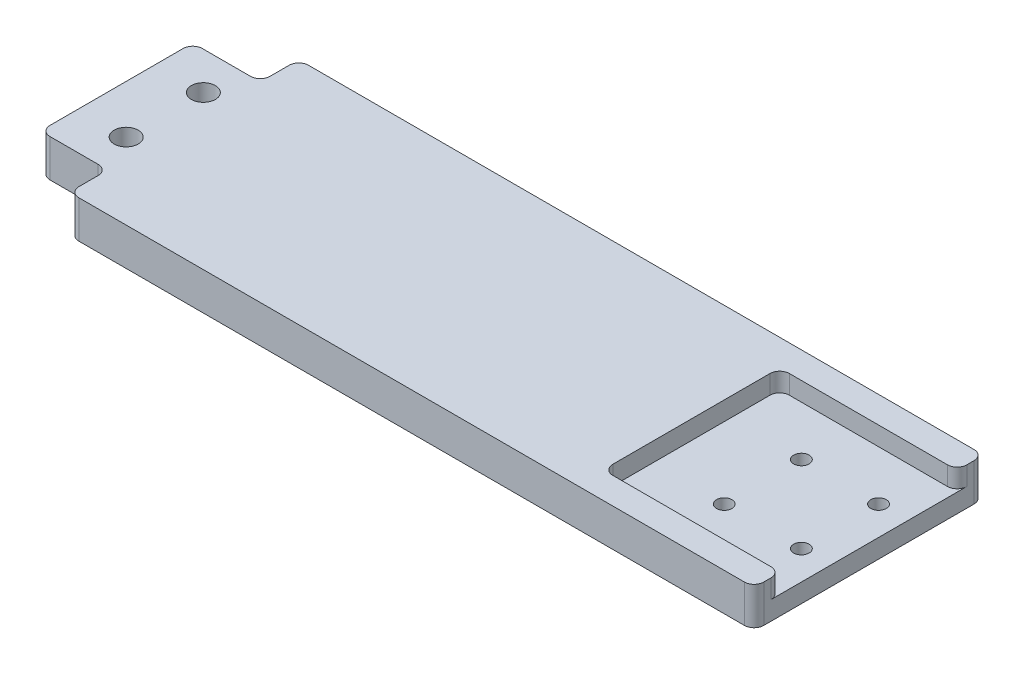
from build123d import *

# Parameters (mm, degrees)
SKETCH5_W            = 82
SKETCH5_H            = 23.8
BOSS_EXTRUDE1_DEPTH  = 3.9
M2_TAPPED_HOLE1_D    = 1.6
LPATTERN1_COUNT      = 2
LPATTERN1_PITCH      = 8
LPATTERN1_COUNT_DIR2 = 2
LPATTERN1_PITCH_DIR2 = 8
CUT_EXTRUDE2_START   = 3.9
REF_JOIN_CUT_FRONT_W = 18.4
REF_JOIN_CUT_FRONT_H = 18.3
CUT_EXTRUDE2_DEPTH   = 1.95
M3_TAPPED_HOLE2_D    = 2.5
LPATTERN2_COUNT      = 2
LPATTERN2_PITCH      = 8
CUT_EXTRUDE4_DEPTH   = 100.788877136
FILLET4_R            = 1
FILLET6_R            = 1


with BuildPart() as part:
    # Sketch5 → Boss-Extrude1 (new body)
    with BuildSketch(Plane(origin=(0, 0, 0), x_dir=(1, 0, 0), z_dir=(0, 1, 0))):
        with Locations((-58, 0)):
            Rectangle(SKETCH5_W, SKETCH5_H)
    extrude(amount=BOSS_EXTRUDE1_DEPTH)

    # M2 Tapped Hole1 (through all)
    with Locations(Plane(origin=(0, 3.9, 0), x_dir=(1, 0, 0), z_dir=(0, 1, 0))):
        with Locations((-20, 4)):
            m2_tapped_hole1 = Hole(M2_TAPPED_HOLE1_D / 2)

    # LPattern1: M2 Tapped Hole1 2 × 2
    with Locations(*[(-j * LPATTERN1_PITCH_DIR2, 0, i * LPATTERN1_PITCH) for i in range(LPATTERN1_COUNT) for j in range(LPATTERN1_COUNT_DIR2) if (i, j) != (0, 0)]):
        add(m2_tapped_hole1, mode=Mode.SUBTRACT)

    # Ref join cut, Front → Cut-Extrude2 (cut)
    with BuildSketch(Plane(origin=(0, 0, 0), x_dir=(-1, 0, 0), z_dir=(0, 1, 0)).offset(CUT_EXTRUDE2_START)):
        with Locations((26.2, 0)):
            Rectangle(REF_JOIN_CUT_FRONT_W, REF_JOIN_CUT_FRONT_H)
    extrude(amount=-CUT_EXTRUDE2_DEPTH, mode=Mode.SUBTRACT)

    # M3 Tapped Hole2 (through all)
    with Locations(Plane(origin=(0, 3.9, 0), x_dir=(1, 0, 0), z_dir=(0, 1, 0))):
        with Locations((-90, 4)):
            m3_tapped_hole2 = Hole(M3_TAPPED_HOLE2_D / 2)

    # LPattern2: M3 Tapped Hole2 ×2
    with Locations(*[(0, 0, i * LPATTERN2_PITCH) for i in range(1, LPATTERN2_COUNT)]):
        add(m3_tapped_hole2, mode=Mode.SUBTRACT)

    # Sketch13 → Cut-Extrude4 (cut, through all)
    with BuildSketch(Plane(origin=(0, 3.9, 0), x_dir=(1, 0, 0), z_dir=(0, 1, 0))):
        Polygon((-88, -11.9), (-88, -7.9), (-95, -7.9), (-95, 7.9), (-88, 7.9), (-88, 11.9), (-99, 11.9), (-99, -11.9), align=None)
    extrude(amount=-CUT_EXTRUDE4_DEPTH, mode=Mode.SUBTRACT)

    # Fillet4
    fillet4_edges = [part.edges().sort_by_distance(p)[0] for p in [
        (-88, 1.95, 11.9),
        (-88, 1.95, -11.9),
        (-88, 1.95, -7.9),
        (-95, 1.95, -7.9),
        (-95, 1.95, 7.9),
        (-88, 1.95, 7.9),
    ]]
    fillet(fillet4_edges, radius=FILLET4_R)

    # Fillet6
    fillet6_edges = [part.edges().sort_by_distance(p)[0] for p in [
        (-35.4, 2.925, -9.15),
        (-17, 2.925, -9.15),
        (-17, 2.925, 9.15),
        (-35.4, 2.925, 9.15),
        (-17, 1.95, -11.9),
        (-17, 1.95, 11.9),
    ]]
    fillet(fillet6_edges, radius=FILLET6_R)


solid = part.part
